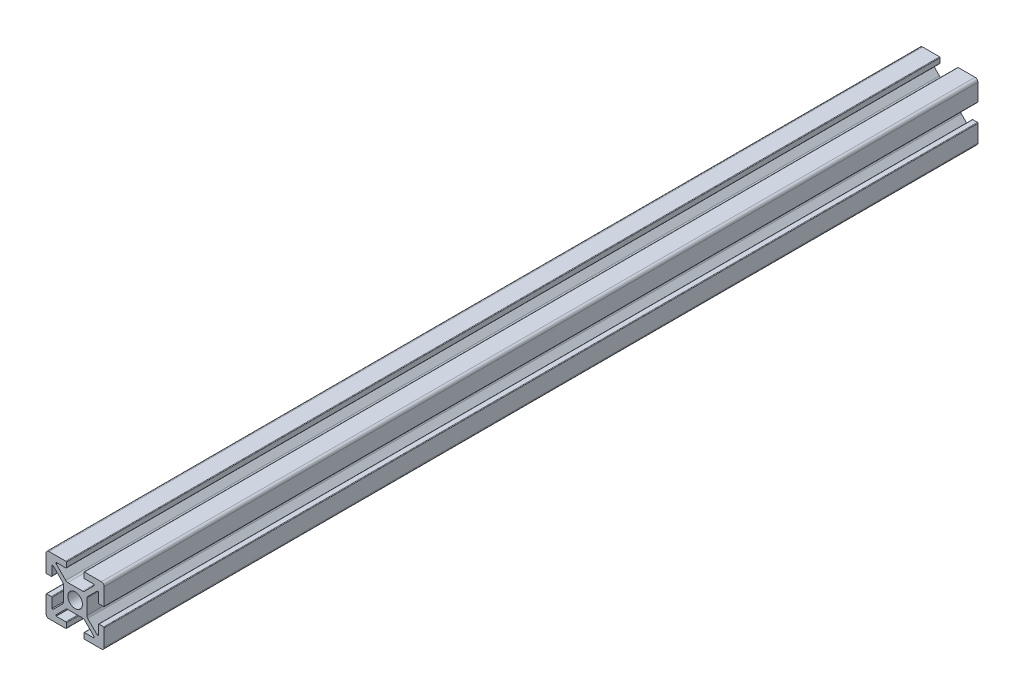
from build123d import *

# Parameters (mm, degrees)
SKETCH1_R           = 2.5
BOSS_EXTRUDE1_DEPTH = 300


with BuildPart() as part:
    # Sketch1 → Boss-Extrude1 (new body)
    with BuildSketch(Plane.XY):
        with BuildLine():
            Line((0.2, 13), (1.8, 13))
            ThreePointArc((1.8, 13), (1.941421356, 13.058578644), (2, 13.2))
            Line((2, 13.2), (2, 16.5))
            Line((2, 16.5), (2.439339828, 16.5))
            Line((2.439339828, 16.5), (5.707106781, 13.232233047))
            ThreePointArc((5.707106781, 13.232233047), (5.923879533, 12.907809698), (6, 12.525126266))
            Line((6, 12.525126266), (6, 7.474873734))
            ThreePointArc((6, 7.474873734), (5.923879533, 7.092190302), (5.707106781, 6.767766953))
            Line((5.707106781, 6.767766953), (2.439339828, 3.5))
            Line((2.439339828, 3.5), (2, 3.5))
            Line((2, 3.5), (2, 6.8))
            ThreePointArc((2, 6.8), (1.941421356, 6.941421356), (1.8, 7))
            Line((1.8, 7), (0.2, 7))
            ThreePointArc((0.2, 7), (0.058578644, 6.941421356), (0, 6.8))
            Line((0, 6.8), (0, 1))
            ThreePointArc((0, 1), (0.292893219, 0.292893219), (1, 0))
            Line((1, 0), (6.8, 0))
            ThreePointArc((6.8, 0), (6.941421356, 0.058578644), (7, 0.2))
            Line((7, 0.2), (7, 1.8))
            ThreePointArc((7, 1.8), (6.941421356, 1.941421356), (6.8, 2))
            Line((6.8, 2), (3.5, 2))
            Line((3.5, 2), (3.5, 2.439339828))
            Line((3.5, 2.439339828), (6.767766953, 5.707106781))
            ThreePointArc((6.767766953, 5.707106781), (7.092190302, 5.923879533), (7.474873734, 6))
            Line((7.474873734, 6), (10, 6))
            Line((10, 6), (12.525126266, 6))
            ThreePointArc((12.525126266, 6), (12.907809698, 5.923879533), (13.232233047, 5.707106781))
            Line((13.232233047, 5.707106781), (16.5, 2.439339828))
            Line((16.5, 2.439339828), (16.5, 2))
            Line((16.5, 2), (13.2, 2))
            ThreePointArc((13.2, 2), (13.058578644, 1.941421356), (13, 1.8))
            Line((13, 1.8), (13, 0.2))
            ThreePointArc((13, 0.2), (13.058578644, 0.058578644), (13.2, 0))
            Line((13.2, 0), (19, 0))
            ThreePointArc((19, 0), (19.707106781, 0.292893219), (20, 1))
            Line((20, 1), (20, 6.8))
            ThreePointArc((20, 6.8), (19.941421356, 6.941421356), (19.8, 7))
            Line((19.8, 7), (18.2, 7))
            ThreePointArc((18.2, 7), (18.058578644, 6.941421356), (18, 6.8))
            Line((18, 6.8), (18, 3.5))
            Line((18, 3.5), (17.560660172, 3.5))
            Line((17.560660172, 3.5), (14.292893219, 6.767766953))
            ThreePointArc((14.292893219, 6.767766953), (14.076120467, 7.092190302), (14, 7.474873734))
            Line((14, 7.474873734), (14, 12.525126266))
            ThreePointArc((14, 12.525126266), (14.076120467, 12.907809698), (14.292893219, 13.232233047))
            Line((14.292893219, 13.232233047), (17.560660172, 16.5))
            Line((17.560660172, 16.5), (18, 16.5))
            Line((18, 16.5), (18, 13.2))
            ThreePointArc((18, 13.2), (18.058578644, 13.058578644), (18.2, 13))
            Line((18.2, 13), (19.8, 13))
            ThreePointArc((19.8, 13), (19.941421356, 13.058578644), (20, 13.2))
            Line((20, 13.2), (20, 19))
            ThreePointArc((20, 19), (19.707106781, 19.707106781), (19, 20))
            Line((19, 20), (13.2, 20))
            ThreePointArc((13.2, 20), (13.058578644, 19.941421356), (13, 19.8))
            Line((13, 19.8), (13, 18.2))
            ThreePointArc((13, 18.2), (13.058578644, 18.058578644), (13.2, 18))
            Line((13.2, 18), (16.5, 18))
            Line((16.5, 18), (16.5, 17.560660172))
            Line((16.5, 17.560660172), (13.232233047, 14.292893219))
            ThreePointArc((13.232233047, 14.292893219), (12.907809698, 14.076120467), (12.525126266, 14))
            Line((12.525126266, 14), (10, 14))
            Line((10, 14), (7.474873734, 14))
            ThreePointArc((7.474873734, 14), (7.092190302, 14.076120467), (6.767766953, 14.292893219))
            Line((6.767766953, 14.292893219), (3.5, 17.560660172))
            Line((3.5, 17.560660172), (3.5, 18))
            Line((3.5, 18), (6.8, 18))
            ThreePointArc((6.8, 18), (6.941421356, 18.058578644), (7, 18.2))
            Line((7, 18.2), (7, 19.8))
            ThreePointArc((7, 19.8), (6.941421356, 19.941421356), (6.8, 20))
            Line((6.8, 20), (1, 20))
            ThreePointArc((1, 20), (0.292893219, 19.707106781), (0, 19))
            Line((0, 19), (0, 13.2))
            ThreePointArc((0, 13.2), (0.058578644, 13.058578644), (0.2, 13))
        make_face()
        with Locations((10, 10)):
            Circle(SKETCH1_R, mode=Mode.SUBTRACT)
    extrude(amount=BOSS_EXTRUDE1_DEPTH)


solid = part.part
